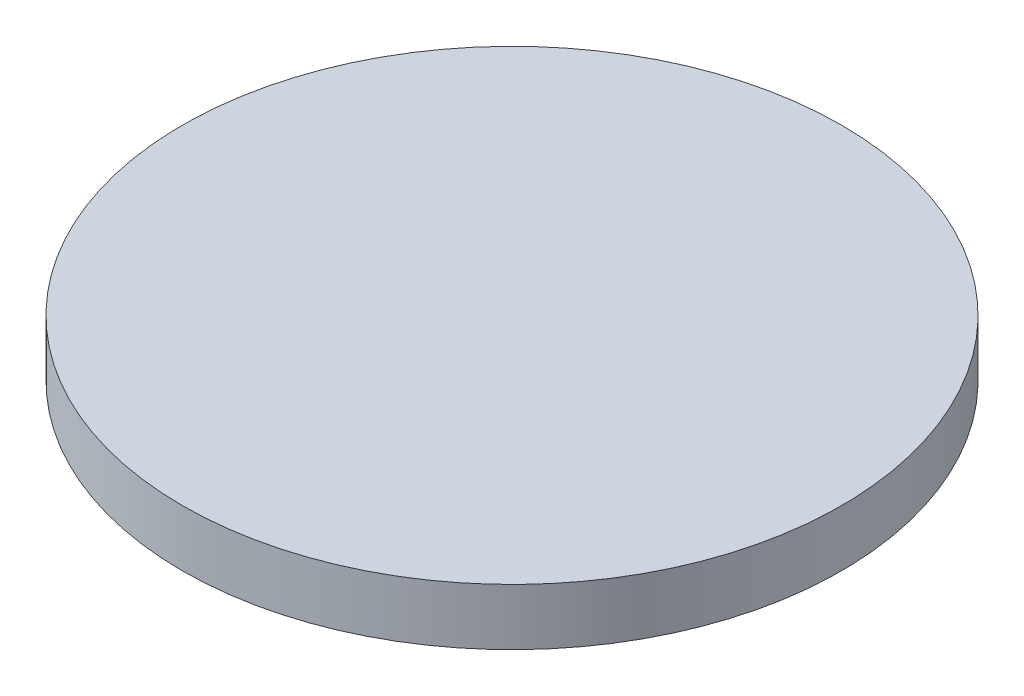
from build123d import *

# Parameters (mm, degrees)
SKETCH1_R           = 4.445
SKETCH1_R_2         = 3.038282762
BOSS_EXTRUDE1_DEPTH = 0.762


with BuildPart() as part:
    # Sketch1 → Boss-Extrude1 (new body)
    # profile 1 of 2: a face of its own
    with BuildSketch(Plane(origin=(0, 0, 0), x_dir=(1, 0, 0), z_dir=(0, 1, 0))):
        with Locations(Location((0, 0, 0), (0, 0, 90))):
            Circle(SKETCH1_R)
        Circle(SKETCH1_R_2, mode=Mode.SUBTRACT)
    # profile 2 of 2: a face of its own
    with BuildSketch(Plane(origin=(0, 0, 0), x_dir=(1, 0, 0), z_dir=(0, 1, 0))):
        Circle(SKETCH1_R_2)
    extrude(amount=BOSS_EXTRUDE1_DEPTH)


solid = part.part
